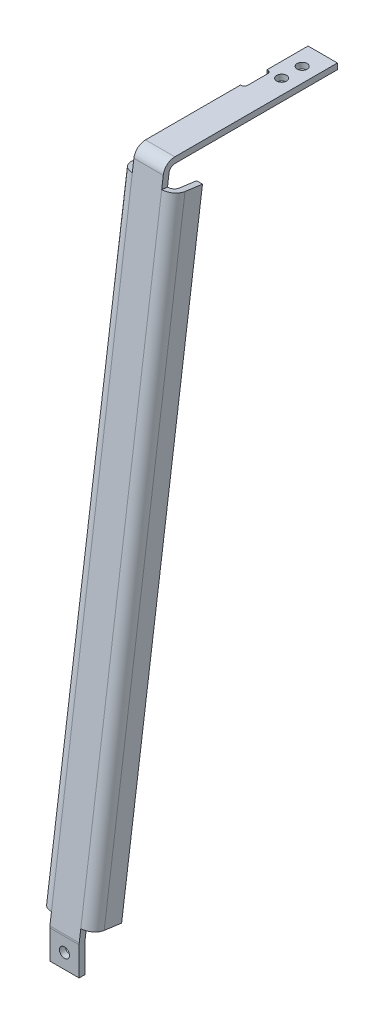
from build123d import *

# Parameters (mm, degrees)
FORMED_WEB_DEPTH           = 10
EDGE_STIFFENING_LIPS_DEPTH = 206.123068282
WALL_MOUNT_HOLE_SKETCH_R   = 1.7
WALL_MOUNT_HOLES_DEPTH     = 2.4
COVER_MOUNT_HOLE_SKETCH_R  = 1.7
COVER_MOUNT_HOLE_DEPTH     = 2.4
FRAME_MOUNT_RELIEF_DEPTH   = 2.4


with BuildPart() as part:
    # Formed Web Section Sketch → Formed Web (new body)
    with BuildSketch(Plane(origin=(-30, 0, 0), x_dir=(0, 0, -1), z_dir=(1, 0, 0))):
        with BuildLine():
            Line((-22, -64), (-77.377483747, -64))
            ThreePointArc((-77.377483747, -64), (-80.010089753, -64.988457933), (-81.341585612, -67.46530719))
            Line((-81.341585612, -67.46530719), (-109.964101865, -279.66672079))
            ThreePointArc((-109.964101865, -279.66672079), (-109.991015376, -279.933465342), (-110, -280.2014136))
            Line((-110, -280.2014136), (-110, -290))
            Line((-110, -290), (-108, -290))
            Line((-108, -290), (-108, -280.2014136))
            ThreePointArc((-108, -280.2014136), (-107.995507688, -280.067439471), (-107.982050933, -279.934067195))
            Line((-107.982050933, -279.934067195), (-79.35953468, -67.732653595))
            ThreePointArc((-79.35953468, -67.732653595), (-78.69378675, -66.494228967), (-77.377483747, -66))
            Line((-77.377483747, -66), (-22, -66))
            Line((-22, -66), (-22, -64))
        make_face()
    extrude(amount=FORMED_WEB_DEPTH)

    # Edge Lip Sketch → Edge Stiffening Lips (add)
    with BuildSketch(Plane(origin=(0, -80.999511953, 10.925515566), x_dir=(-1, 0, 0), z_dir=(0, -0.9910254663478989, 0.1336732024376229))):
        with BuildLine():
            Line((34, -67.593279149), (34, -61.593279149))
            Line((34, -61.593279149), (32, -61.593279149))
            Line((32, -61.593279149), (32, -67.593279149))
            ThreePointArc((32, -67.593279149), (31.414213562, -69.007492712), (30, -69.593279149))
            Line((30, -69.593279149), (29.9, -69.593279149))
            Line((29.9, -69.593279149), (29.9, -71.593279149))
            Line((29.9, -71.593279149), (30, -71.593279149))
            ThreePointArc((30, -71.593279149), (32.828427125, -70.421706274), (34, -67.593279149))
        make_face()
        with BuildLine():
            Line((16, -67.593279149), (16, -61.593279149))
            Line((16, -61.593279149), (18, -61.593279149))
            Line((18, -61.593279149), (18, -67.593279149))
            ThreePointArc((18, -67.593279149), (18.585786438, -69.007492712), (20, -69.593279149))
            Line((20, -69.593279149), (20.1, -69.593279149))
            Line((20.1, -69.593279149), (20.1, -71.593279149))
            Line((20.1, -71.593279149), (20, -71.593279149))
            ThreePointArc((20, -71.593279149), (17.171572875, -70.421706274), (16, -67.593279149))
        make_face()
    extrude(amount=EDGE_STIFFENING_LIPS_DEPTH)

    # Wall Mount Hole Sketch → Wall Mount Holes (cut)
    with BuildSketch(Plane(origin=(0, -63.8, 0), x_dir=(-1, 0, 0), z_dir=(0, -1, 0))):
        with Locations(Location((25, -29, 0), (0, 0, 270))):
            Circle(WALL_MOUNT_HOLE_SKETCH_R)
        with Locations(Location((25, -36, 0), (0, 0, 270))):
            Circle(WALL_MOUNT_HOLE_SKETCH_R)
    extrude(amount=WALL_MOUNT_HOLES_DEPTH, mode=Mode.SUBTRACT)

    # Cover Mount Hole Sketch → Cover Mount Hole (cut)
    with BuildSketch(Plane.XY.offset(107.8)):
        with Locations(Location((-25, -285, 0), (0, 0, 90))):
            Circle(COVER_MOUNT_HOLE_SKETCH_R)
    extrude(amount=COVER_MOUNT_HOLE_DEPTH, mode=Mode.SUBTRACT)

    # Frame Mount Relief Sketch → Frame Mount Relief (cut)
    with BuildSketch(Plane(origin=(0, -63.8, 0), x_dir=(-1, 0, 0), z_dir=(0, -1, 0))):
        with BuildLine():
            Line((30, -36), (29.7, -36))
            ThreePointArc((29.7, -36), (28.992893219, -36.292893219), (28.7, -37))
            Line((28.7, -37), (28.7, -44))
            ThreePointArc((28.7, -44), (28.992893219, -44.707106781), (29.7, -45))
            Line((29.7, -45), (30, -45))
            ThreePointArc((30, -45), (30.707106781, -44.707106781), (31, -44))
            Line((31, -44), (31, -37))
            ThreePointArc((31, -37), (30.707106781, -36.292893219), (30, -36))
        make_face()
    extrude(amount=FRAME_MOUNT_RELIEF_DEPTH, mode=Mode.SUBTRACT)


solid = part.part
